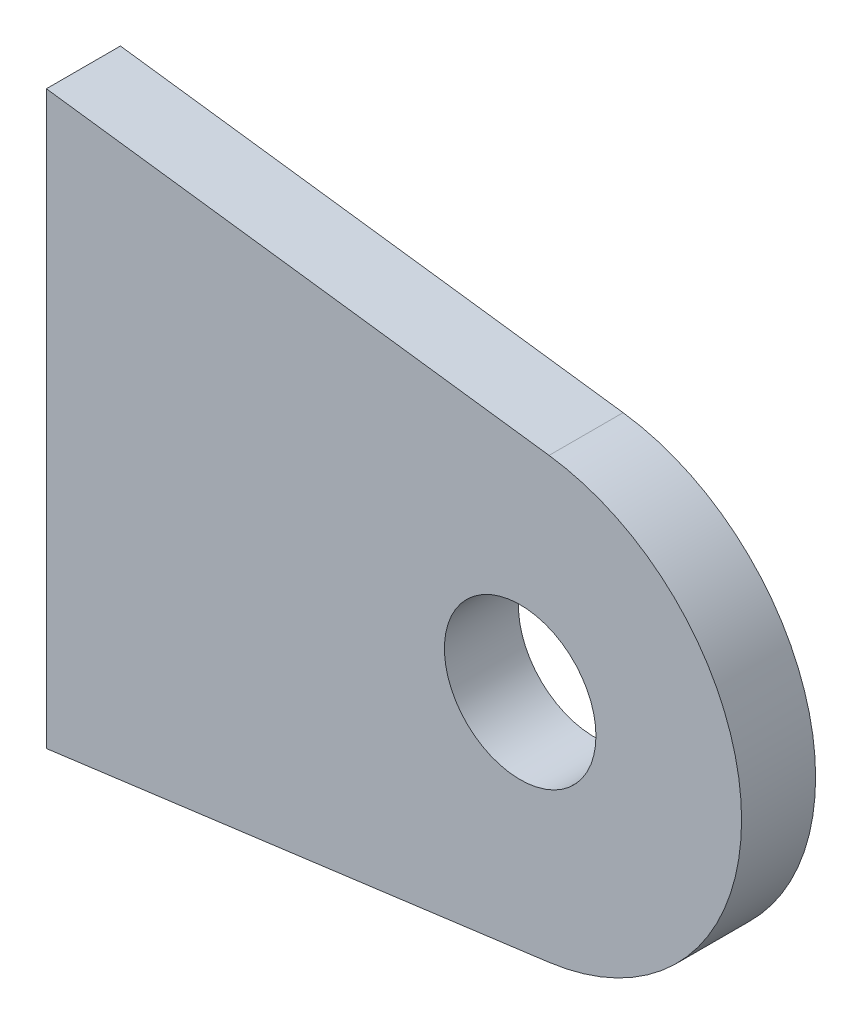
from build123d import *

# Parameters (mm, degrees)
SKETCH1_R           = 3.25
BOSS_EXTRUDE1_DEPTH = 3.175


with BuildPart() as part:
    # Sketch1 → Boss-Extrude1 (new body)
    with BuildSketch(Plane(origin=(-1053.740804459, 0, 0), x_dir=(1, 0, 0), z_dir=(0, 0, 1))):
        with BuildLine():
            Line((1033.420804459, -12.253050985), (1054.980272331, -9.414693193))
            ThreePointArc((1054.980272331, -9.414693193), (1063.236736668, 0), (1054.980272331, 9.414693193))
            Line((1054.980272331, 9.414693193), (1033.420804459, 12.253050985))
            Line((1033.420804459, 12.253050985), (1033.420804459, -12.253050985))
        make_face()
        with Locations((1053.740804459, 0)):
            Circle(SKETCH1_R, mode=Mode.SUBTRACT)
    extrude(amount=BOSS_EXTRUDE1_DEPTH)


solid = part.part
